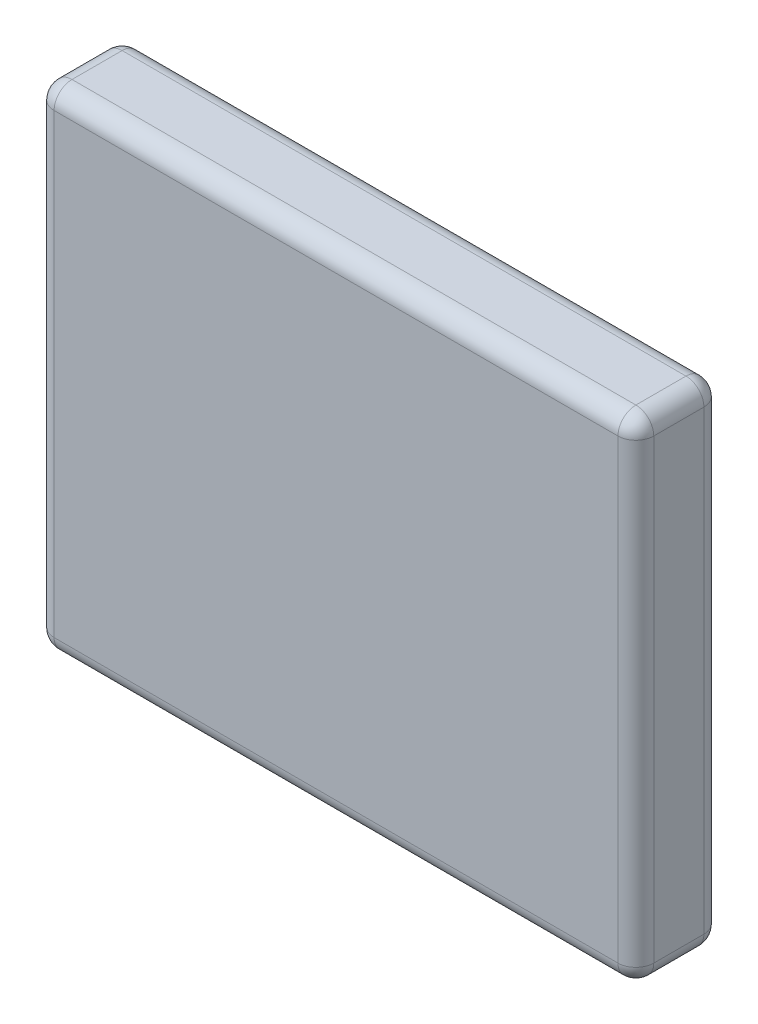
from build123d import *

# Parameters (mm, degrees)
SKETCH1_W           = 67
SKETCH1_H           = 55
BOSS_EXTRUDE1_DEPTH = 9.6
FILLET1_R           = 2


with BuildPart() as part:
    # Sketch1 → Boss-Extrude1 (new body)
    with BuildSketch(Plane.XY):
        Rectangle(SKETCH1_W, SKETCH1_H)
    extrude(amount=BOSS_EXTRUDE1_DEPTH)

    # Fillet1
    fillet1_edges = [part.edges().sort_by_distance(p)[0] for p in [
        (-33.5, 0, 9.6),
        (0, -27.5, 9.6),
        (33.5, 0, 9.6),
        (0, -27.5, 0),
        (-33.5, 0, 0),
        (0, 27.5, 0),
        (33.5, 0, 0),
        (33.5, -27.5, 4.8),
        (-33.5, -27.5, 4.8),
        (-33.5, 27.5, 4.8),
        (33.5, 27.5, 4.8),
        (0, 27.5, 9.6),
    ]]
    fillet(fillet1_edges, radius=FILLET1_R)


solid = part.part
